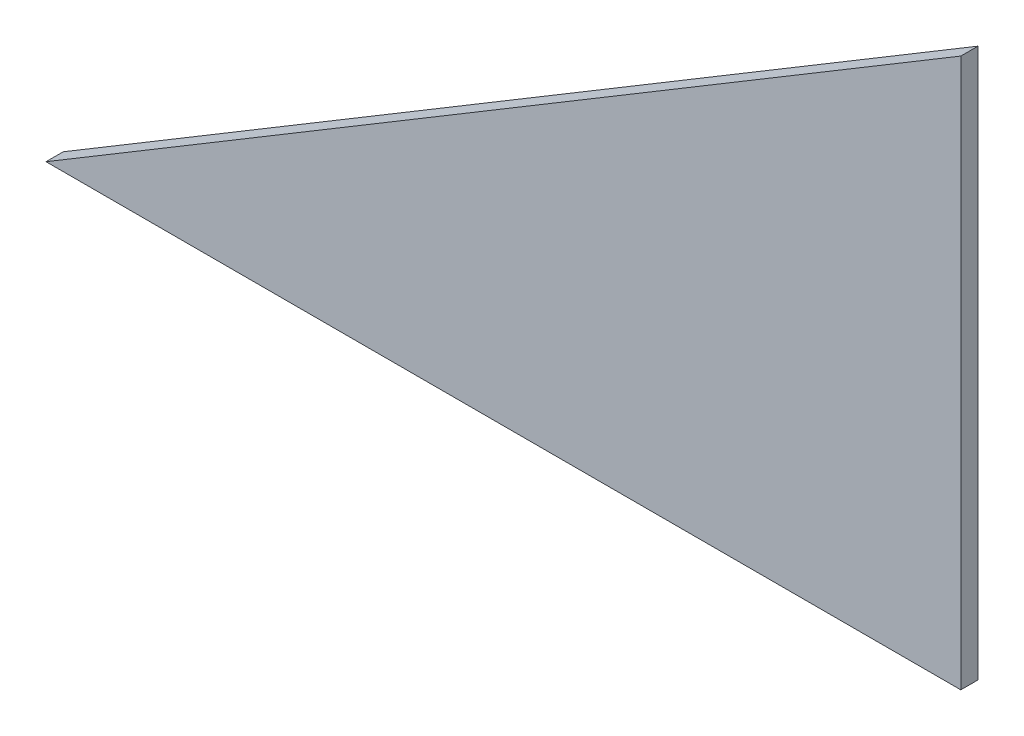
from build123d import *

# Parameters (mm, degrees)
BOSS_EXTRUDE1_DEPTH = 2.3876


with BuildPart() as part:
    # Sketch1 → Boss-Extrude1 (new body)
    with BuildSketch(Plane.XY):
        Polygon((0, 0), (-127, 0), (0, 76.2), align=None)
    extrude(amount=BOSS_EXTRUDE1_DEPTH)


solid = part.part
